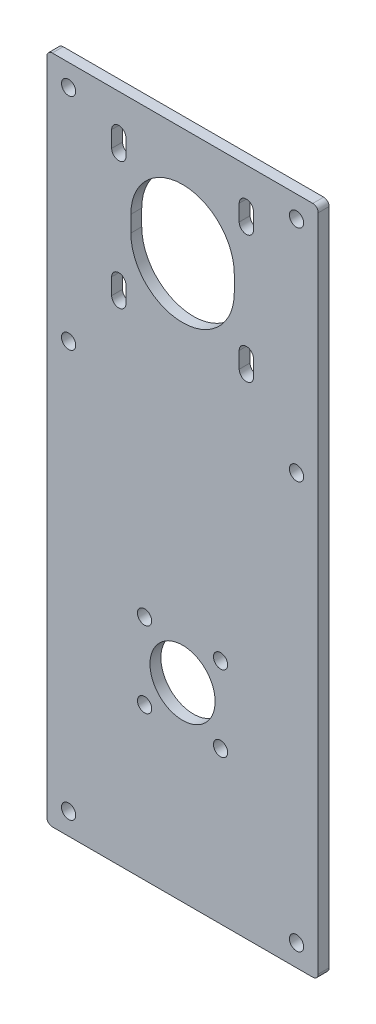
from build123d import *

# Parameters (mm, degrees)
SKETCH1_R           = 2.625
SKETCH1_R_2         = 12
BOSS_EXTRUDE1_DEPTH = 4


with BuildPart() as part:
    # Sketch1 → Boss-Extrude1 (new body)
    with BuildSketch(Plane.XY.offset(4)):
        with BuildLine():
            Line((-48, -123.5), (48, -123.5))
            ThreePointArc((48, -123.5), (49.414213562, -122.914213562), (50, -121.5))
            Line((50, -121.5), (50, 121.5))
            ThreePointArc((50, 121.5), (49.414213562, 122.914213562), (48, 123.5))
            Line((48, 123.5), (-48, 123.5))
            ThreePointArc((-48, 123.5), (-49.414213562, 122.914213562), (-50, 121.5))
            Line((-50, 121.5), (-50, -121.5))
            ThreePointArc((-50, -121.5), (-49.414213562, -122.914213562), (-48, -123.5))
        make_face()
        with Locations(Location((14, -67.5, 0), (0, 0, 180))):
            Circle(SKETCH1_R, mode=Mode.SUBTRACT)
        with Locations(Location((-14, -67.5, 0), (0, 0, 180))):
            Circle(SKETCH1_R, mode=Mode.SUBTRACT)
        with Locations(Location((14, -39.5, 0), (0, 0, 180))):
            Circle(SKETCH1_R, mode=Mode.SUBTRACT)
        with Locations(Location((42, 115.5, 0), (0, 0, 180))):
            Circle(SKETCH1_R, mode=Mode.SUBTRACT)
        with Locations(Location((0, -53.5, 0), (0, 0, 180))):
            Circle(SKETCH1_R_2, mode=Mode.SUBTRACT)
        with Locations(Location((-42, 34.5, 0), (0, 0, 180))):
            Circle(SKETCH1_R, mode=Mode.SUBTRACT)
        with Locations(Location((-42, -115.5, 0), (0, 0, 180))):
            Circle(SKETCH1_R, mode=Mode.SUBTRACT)
        with Locations(Location((-14, -39.5, 0), (0, 0, 180))):
            Circle(SKETCH1_R, mode=Mode.SUBTRACT)
        with Locations(Location((42, 34.5, 0), (0, 0, 180))):
            Circle(SKETCH1_R, mode=Mode.SUBTRACT)
        with Locations(Location((42, -115.5, 0), (0, 0, 180))):
            Circle(SKETCH1_R, mode=Mode.SUBTRACT)
        with Locations(Location((-42, 115.5, 0), (0, 0, 180))):
            Circle(SKETCH1_R, mode=Mode.SUBTRACT)
        with BuildLine():
            Line((-26.13, 57), (-26.13, 63))
            ThreePointArc((-26.13, 63), (-23.5, 65.63), (-20.87, 63))
            Line((-20.87, 63), (-20.87, 57))
            ThreePointArc((-20.87, 57), (-23.5, 54.37), (-26.13, 57))
        make_face(mode=Mode.SUBTRACT)
        with BuildLine():
            Line((20.87, 104), (20.87, 110))
            ThreePointArc((20.87, 110), (23.5, 112.63), (26.13, 110))
            Line((26.13, 110), (26.13, 104))
            ThreePointArc((26.13, 104), (23.5, 101.37), (20.87, 104))
        make_face(mode=Mode.SUBTRACT)
        with BuildLine():
            Line((-19.05, 80.5), (-19.05, 86.5))
            ThreePointArc((-19.05, 86.5), (0, 105.55), (19.05, 86.5))
            Line((19.05, 86.5), (19.05, 80.5))
            ThreePointArc((19.05, 80.5), (0, 61.45), (-19.05, 80.5))
        make_face(mode=Mode.SUBTRACT)
        with BuildLine():
            Line((26.13, 63), (26.13, 57))
            ThreePointArc((26.13, 57), (23.5, 54.37), (20.87, 57))
            Line((20.87, 57), (20.87, 63))
            ThreePointArc((20.87, 63), (23.5, 65.63), (26.13, 63))
        make_face(mode=Mode.SUBTRACT)
        with BuildLine():
            Line((-20.87, 110), (-20.87, 104))
            ThreePointArc((-20.87, 104), (-23.5, 101.37), (-26.13, 104))
            Line((-26.13, 104), (-26.13, 110))
            ThreePointArc((-26.13, 110), (-23.5, 112.63), (-20.87, 110))
        make_face(mode=Mode.SUBTRACT)
    extrude(amount=-BOSS_EXTRUDE1_DEPTH)


solid = part.part
